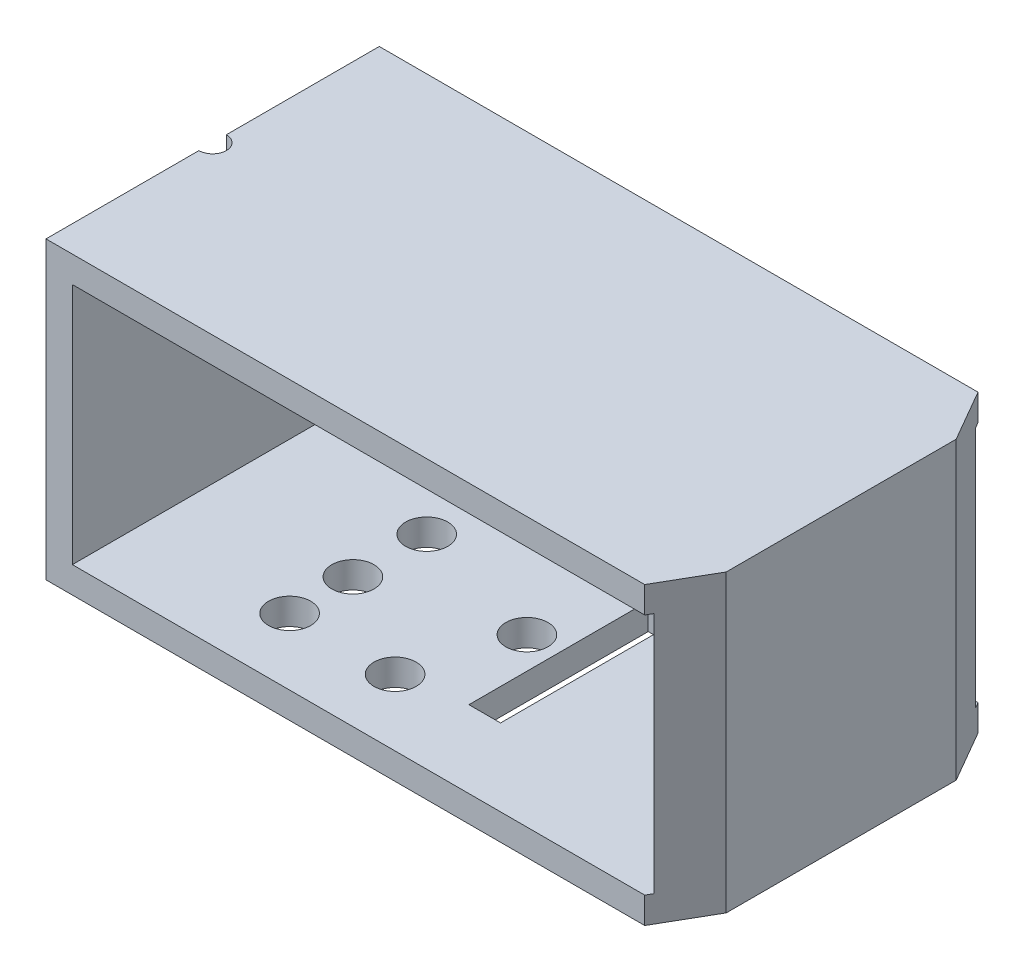
from build123d import *

# Parameters (mm, degrees)
VISTA_FRONTAL_W       = 59.6
VISTA_FRONTAL_H       = 28
VISTA_FRONTAL_W_2     = 54.6
VISTA_FRONTAL_H_2     = 23
CORPO_DO_MODULO_DEPTH = 15.8
ESBO_O3_R             = 1.3
CORTE_EXTRUS_O1_DEPTH = 44.836970698
ESBO_O4_R             = 2
ESBO_O4_W             = 3
ESBO_O4_H             = 17
CORTE_EXTRUS_O2_DEPTH = 3.6


with BuildPart() as part:
    # Vista Frontal → Corpo do Modulo (new, symmetric)
    with BuildSketch(Plane.XY):
        Rectangle(VISTA_FRONTAL_W, VISTA_FRONTAL_H)
        Rectangle(VISTA_FRONTAL_W_2, VISTA_FRONTAL_H_2, mode=Mode.SUBTRACT)
    extrude(amount=CORPO_DO_MODULO_DEPTH, both=True)

    # Esboço3 → Corte-extrusão1 (cut, through all)
    with BuildSketch(Plane(origin=(0, 14, 0), x_dir=(1, 0, 0), z_dir=(0, 1, 0))):
        with Locations((-29.8, 0)):
            Circle(ESBO_O3_R)
        Polygon((26.970983681, -15.8), (29.8, -10.9), (29.8, -15.8), align=None)
        Polygon((29.8, 15.8), (26.970983681, 15.8), (29.8, 10.9), align=None)
    extrude(amount=-CORTE_EXTRUS_O1_DEPTH, mode=Mode.SUBTRACT)

    # Esboço4 → Corte-extrusão2 (cut)
    with BuildSketch(Plane.XZ.offset(14)):
        with Locations(Location((0, 0, 0), (0, 0, 270))):
            Circle(ESBO_O4_R)
        with Locations(Location((-3, 9.5, 0), (0, 0, 270))):
            Circle(ESBO_O4_R)
        with Locations(Location((-13, 9.5, 0), (0, 0, 270))):
            Circle(ESBO_O4_R)
        with Locations(Location((-13, 3.5, 0), (0, 0, 270))):
            Circle(ESBO_O4_R)
        with Locations(Location((-13, -3.5, 0), (0, 0, 90))):
            Circle(ESBO_O4_R)
        with Locations(Location((-13, -9.5, 0), (0, 0, 90))):
            Circle(ESBO_O4_R)
        with Locations(Location((-3, -9.5, 0), (0, 0, 90))):
            Circle(ESBO_O4_R)
        with Locations((4.5, 0)):
            Rectangle(ESBO_O4_W, ESBO_O4_H)
    extrude(amount=-CORTE_EXTRUS_O2_DEPTH, mode=Mode.SUBTRACT)


solid = part.part
